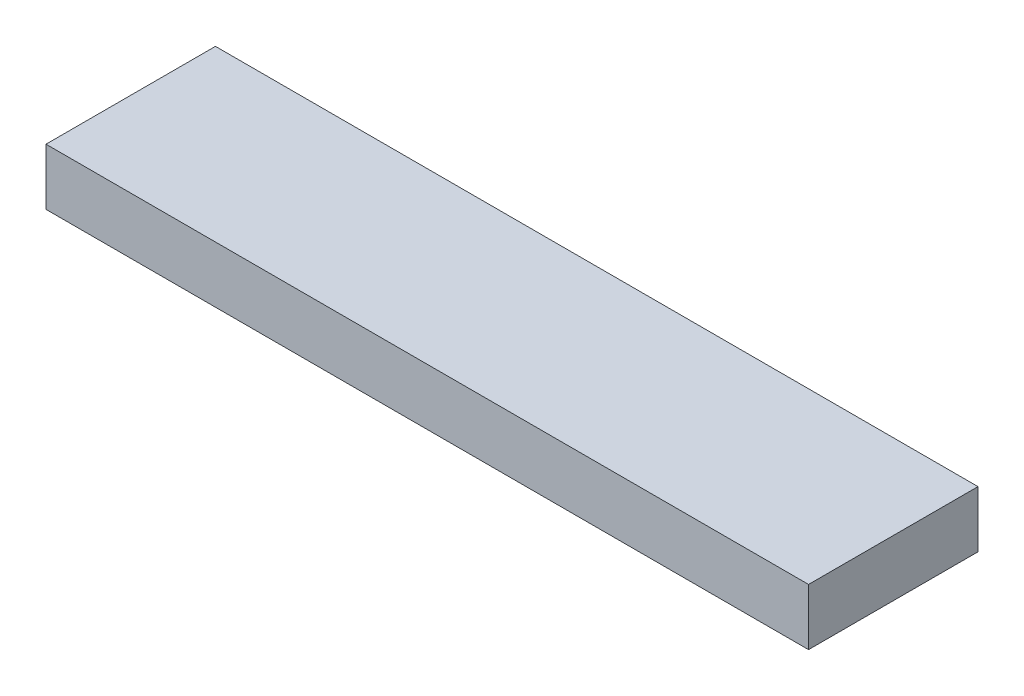
from build123d import *

# Parameters (mm, degrees)
SKETCH1_W           = 85.725
SKETCH1_H           = 19.05
BOSS_EXTRUDE1_DEPTH = 6.35


with BuildPart() as part:
    # Sketch1 → Boss-Extrude1 (new body)
    with BuildSketch(Plane(origin=(0, 0, 0), x_dir=(1, 0, 0), z_dir=(0, 1, 0))):
        with Locations((19.425585404, 6.708082707)):
            Rectangle(SKETCH1_W, SKETCH1_H)
    extrude(amount=BOSS_EXTRUDE1_DEPTH)


solid = part.part
